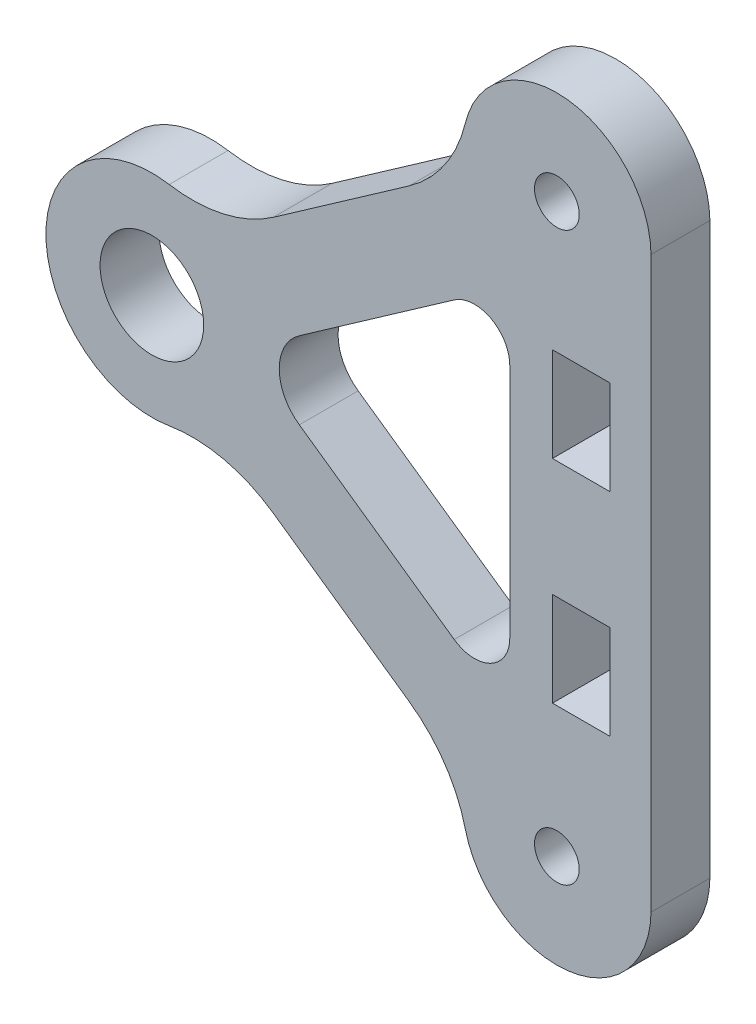
from build123d import *

# Parameters (mm, degrees)
ESQUISSE1_R        = 1.9
ESQUISSE1_R_2      = 4.4
ESQUISSE1_W        = 4.89999982
ESQUISSE1_H        = 8.00000038
BOSS_EXTRU_1_DEPTH = 5


with BuildPart() as part:
    # Esquisse1 → Boss.-Extru.1 (new body)
    with BuildSketch(Plane.XY):
        with BuildLine():
            Line((25.70156774, 24.190208374), (25.70156774, -24.190208374))
            ThreePointArc((25.70156774, -24.190208374), (18.599090239, -32.039774771), (9.926188952, -25.970041455))
            ThreePointArc((9.926188952, -25.970041455), (8.175930594, -22.028307987), (5.145100617, -18.959963694))
            Line((5.145100617, -18.959963694), (-6.383895202, -10.887273587))
            ThreePointArc((-6.383895202, -10.887273587), (-10.60979376, -9.014950874), (-15.229887052, -8.87875638))
            ThreePointArc((-15.229887052, -8.87875638), (-25.702193121, 0), (-15.229887052, 8.87875638))
            ThreePointArc((-15.229887052, 8.87875638), (-10.60979376, 9.014950873), (-6.383895202, 10.887273587))
            Line((-6.383895202, 10.887273587), (5.145100617, 18.959963694))
            ThreePointArc((5.145100617, 18.959963694), (8.175930651, 22.028307983), (9.926189014, 25.970041482))
            ThreePointArc((9.926189014, 25.970041482), (18.59909026, 32.03977477), (25.70156774, 24.190208374))
        make_face()
        with Locations((17.70219274, 24.090210327)):
            Circle(ESQUISSE1_R, mode=Mode.SUBTRACT)
        with Locations((17.70219274, -24.090210327)):
            Circle(ESQUISSE1_R, mode=Mode.SUBTRACT)
        with Locations((-16.70219312, 0)):
            Circle(ESQUISSE1_R_2, mode=Mode.SUBTRACT)
        with BuildLine():
            Line((8.98146324, -12.490403838), (-4.177200867, -3.276608186))
            ThreePointArc((-4.177200867, -3.276608186), (-5.882895134, 0), (-4.177200867, 3.276608186))
            Line((-4.177200867, 3.276608186), (8.98146324, 12.490403838))
            ThreePointArc((8.98146324, 12.490403838), (12.087438212, 12.693980299), (13.70219255, 10.032948107))
            Line((13.70219255, 10.032948107), (13.70219255, -10.032948107))
            ThreePointArc((13.70219255, -10.032948107), (12.087438212, -12.693980299), (8.98146324, -12.490403838))
        make_face(mode=Mode.SUBTRACT)
        with Locations((19.777192636, 9.000000078)):
            Rectangle(ESQUISSE1_W, ESQUISSE1_H, mode=Mode.SUBTRACT)
        with Locations((19.777192636, -9.000000078)):
            Rectangle(ESQUISSE1_W, ESQUISSE1_H, mode=Mode.SUBTRACT)
    extrude(amount=BOSS_EXTRU_1_DEPTH)


solid = part.part
